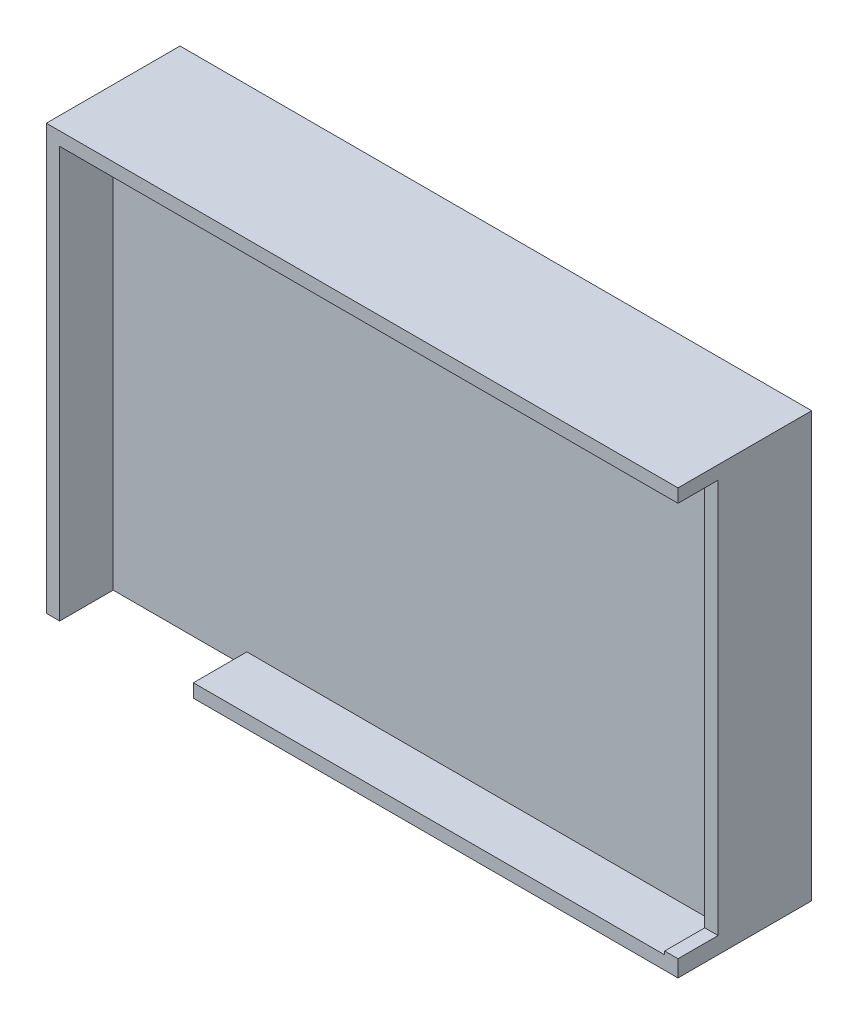
from build123d import *

# Parameters (mm, degrees)
SKETCH1_W           = 94.5
SKETCH1_H           = 63.5
SKETCH1_W_2         = 90.5
SKETCH1_H_2         = 59.5
BOSS_EXTRUDE1_DEPTH = 10
SKETCH2_W           = 94.5
SKETCH2_H           = 63.5
BOSS_EXTRUDE2_DEPTH = 2
SKETCH3_W           = 94.5
SKETCH3_H           = 63.5
SKETCH3_W_2         = 76
SKETCH3_H_2         = 3.3
BOSS_EXTRUDE3_DEPTH = 10
SKETCH5_W           = 20
SKETCH5_H           = 2
CUT_EXTRUDE1_DEPTH  = 8
SKETCH6_W           = 2
SKETCH6_H           = 59
CUT_EXTRUDE2_DEPTH  = 6


with BuildPart() as part:
    # Sketch1 → Boss-Extrude1 (new body)
    with BuildSketch(Plane.XY):
        Rectangle(SKETCH1_W, SKETCH1_H)
        Rectangle(SKETCH1_W_2, SKETCH1_H_2, mode=Mode.SUBTRACT)
    extrude(amount=BOSS_EXTRUDE1_DEPTH)

    # Sketch2 → Boss-Extrude2 (add)
    with BuildSketch(Plane.XY):
        Rectangle(SKETCH2_W, SKETCH2_H)
    extrude(amount=BOSS_EXTRUDE2_DEPTH)

    # Sketch3 → Boss-Extrude3 (add)
    with BuildSketch(Plane(origin=(0, 0, 0), x_dir=(-1, 0, 0), z_dir=(0, 0, -1))):
        Rectangle(SKETCH3_W, SKETCH3_H)
        Rectangle(SKETCH3_W_2, SKETCH3_H_2, mode=Mode.SUBTRACT)
    extrude(amount=BOSS_EXTRUDE3_DEPTH)

    # Sketch5 → Cut-Extrude1 (cut)
    with BuildSketch(Plane.XY.offset(10)):
        with Locations((-35.25, -30.75)):
            Rectangle(SKETCH5_W, SKETCH5_H)
    extrude(amount=-CUT_EXTRUDE1_DEPTH, mode=Mode.SUBTRACT)

    # Sketch6 → Cut-Extrude2 (cut)
    with BuildSketch(Plane.XY.offset(10)):
        with Locations((46.25, 0.25)):
            Rectangle(SKETCH6_W, SKETCH6_H)
    extrude(amount=-CUT_EXTRUDE2_DEPTH, mode=Mode.SUBTRACT)


solid = part.part
